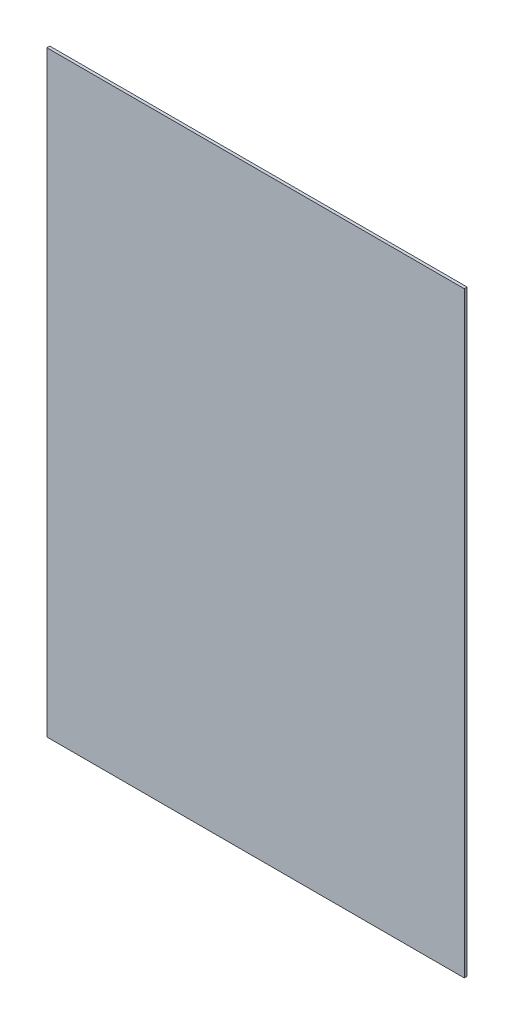
from build123d import *

# Parameters (mm, degrees)
SKETCH2_W           = 288.1
SKETCH2_H           = 411.9
BOSS_EXTRUDE1_DEPTH = 2


with BuildPart() as part:
    # Sketch2 → Boss-Extrude1 (new body)
    with BuildSketch(Plane.XY):
        Rectangle(SKETCH2_W, SKETCH2_H)
    extrude(amount=BOSS_EXTRUDE1_DEPTH)


solid = part.part
